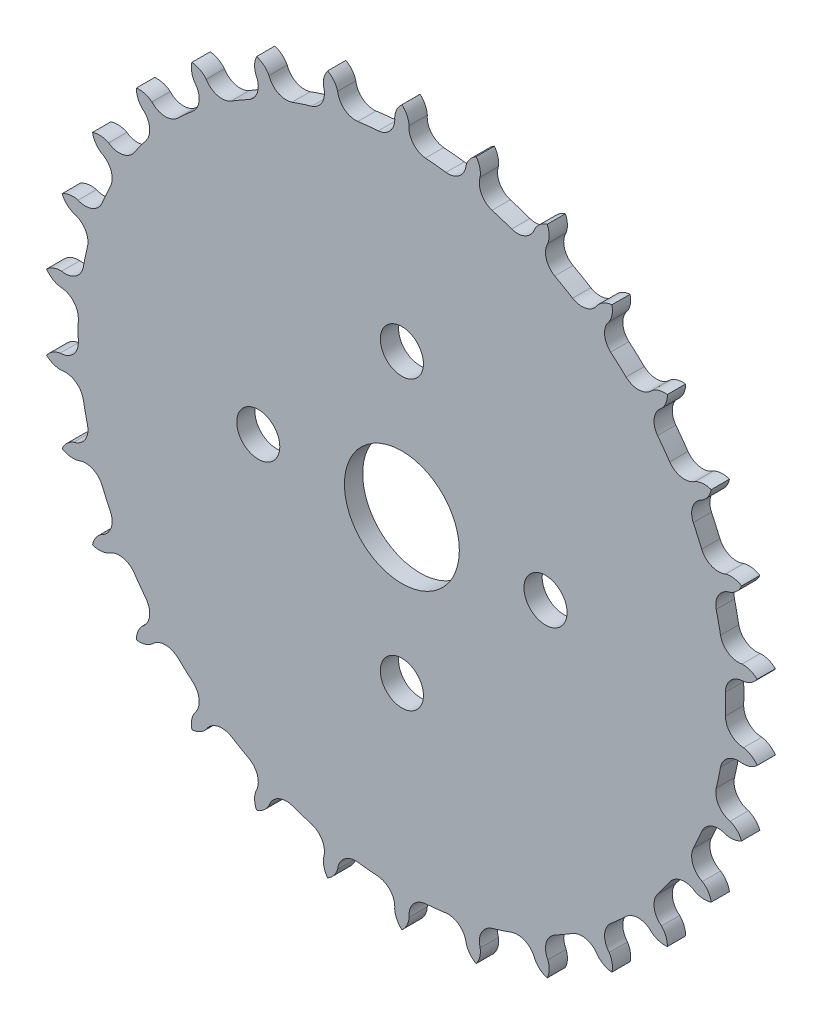
from build123d import *

# Parameters (mm, degrees)
SKETCH1_R           = 1.5
SKETCH1_R_2         = 4
BOSS_EXTRUDE1_DEPTH = 1.27


with BuildPart() as part:
    # Sketch1 → Boss-Extrude1 (new body)
    with BuildSketch(Plane.XY):
        with BuildLine():
            ThreePointArc((-10.640604221, 19.869260188), (-11.26953813, 19.519412618), (-11.886981967, 19.149663661))
            ThreePointArc((-11.886981967, 19.149663661), (-12.849854709, 19.016656043), (-13.624759144, 19.603459299))
            ThreePointArc((-13.624759144, 19.603459299), (-14.070288868, 19.963072671), (-14.620100137, 20.122841504))
            ThreePointArc((-14.620100137, 20.122841504), (-14.638051973, 19.550568629), (-14.433715589, 19.015718039))
            ThreePointArc((-14.433715589, 19.015718039), (-14.115091167, 18.097407948), (-14.53913297, 17.222763166))
            ThreePointArc((-14.53913297, 17.222763166), (-15.081585764, 16.749797893), (-15.608661841, 16.259755046))
            ThreePointArc((-15.608661841, 16.259755046), (-16.522839665, 15.929461463), (-17.402813836, 16.342329969))
            ThreePointArc((-17.402813836, 16.342329969), (-17.913375491, 16.601454087), (-18.484389873, 16.643419398))
            ThreePointArc((-18.484389873, 16.643419398), (-18.382967197, 16.079919662), (-18.071894363, 15.599240763))
            ThreePointArc((-18.071894363, 15.599240763), (-17.569305245, 14.767243693), (-17.802231842, 13.82354875))
            ThreePointArc((-17.802231842, 13.82354875), (-18.234495731, 13.248136625), (-18.648168294, 12.659217112))
            ThreePointArc((-18.648168294, 12.659217112), (-19.473697242, 12.146072979), (-20.420282056, 12.3669624))
            ThreePointArc((-20.420282056, 12.3669624), (-20.973561647, 12.514272298), (-21.540823073, 12.4366))
            ThreePointArc((-21.540823073, 12.4366), (-21.324458543, 11.906501045), (-20.920244634, 11.501001813))
            ThreePointArc((-20.920244634, 11.501001813), (-20.255656377, 10.791680028), (-20.287287758, 9.820178921))
            ThreePointArc((-20.287287758, 9.820178921), (-20.590470736, 9.167468216), (-20.872660309, 8.505410644))
            ThreePointArc((-20.872660309, 8.505410644), (-21.573460805, 7.831842823), (-22.545285962, 7.851099231))
            ThreePointArc((-22.545285962, 7.851099231), (-23.117102516, 7.880156759), (-23.655818941, 7.686241504))
            ThreePointArc((-23.655818941, 7.686241504), (-23.333968725, 7.212711199), (-22.854279828, 6.900113895))
            ThreePointArc((-22.854279828, 6.900113895), (-22.056738128, 6.344468161), (-21.885691849, 5.38762015))
            ThreePointArc((-21.885691849, 5.38762015), (-22.046543366, 4.686137454), (-22.184916911, 3.979876918))
            ThreePointArc((-22.184916911, 3.979876918), (-22.730360609, 3.175323553), (-23.684952687, 2.992105352))
            ThreePointArc((-23.684952687, 2.992105352), (-24.250315078, 2.901640556), (-24.736942008, 2.599957373))
            ThreePointArc((-24.736942008, 2.599957373), (-24.323672505, 2.203691263), (-23.789473327, 1.997657889))
            ThreePointArc((-23.789473327, 1.997657889), (-22.893834583, 1.619972592), (-22.527586188, 0.719596527))
            ThreePointArc((-22.527586188, 0.719596527), (-22.539076259, 0), (-22.527586188, -0.719596527))
            ThreePointArc((-22.527586188, -0.719596527), (-22.893834583, -1.619972592), (-23.789473327, -1.997657889))
            ThreePointArc((-23.789473327, -1.997657889), (-24.323672505, -2.203691263), (-24.736942008, -2.599957373))
            ThreePointArc((-24.736942008, -2.599957373), (-24.250315078, -2.901640556), (-23.684952687, -2.992105352))
            ThreePointArc((-23.684952687, -2.992105352), (-22.730360609, -3.175323553), (-22.184916911, -3.979876918))
            ThreePointArc((-22.184916911, -3.979876918), (-22.046543366, -4.686137454), (-21.885691849, -5.38762015))
            ThreePointArc((-21.885691849, -5.38762015), (-22.056738128, -6.344468161), (-22.854279828, -6.900113895))
            ThreePointArc((-22.854279828, -6.900113895), (-23.333968725, -7.212711199), (-23.655818941, -7.686241504))
            ThreePointArc((-23.655818941, -7.686241504), (-23.117102516, -7.880156759), (-22.545285962, -7.851099231))
            ThreePointArc((-22.545285962, -7.851099231), (-21.573460805, -7.831842823), (-20.872660309, -8.505410644))
            ThreePointArc((-20.872660309, -8.505410644), (-20.590470736, -9.167468216), (-20.287287758, -9.820178921))
            ThreePointArc((-20.287287758, -9.820178921), (-20.255656377, -10.791680028), (-20.920244634, -11.501001813))
            ThreePointArc((-20.920244634, -11.501001813), (-21.324458543, -11.906501045), (-21.540823073, -12.4366))
            ThreePointArc((-21.540823073, -12.4366), (-20.973561647, -12.514272298), (-20.420282056, -12.3669624))
            ThreePointArc((-20.420282056, -12.3669624), (-19.473697242, -12.146072979), (-18.648168294, -12.659217112))
            ThreePointArc((-18.648168294, -12.659217112), (-18.234495731, -13.248136625), (-17.802231842, -13.82354875))
            ThreePointArc((-17.802231842, -13.82354875), (-17.569305245, -14.767243693), (-18.071894363, -15.599240763))
            ThreePointArc((-18.071894363, -15.599240763), (-18.382967197, -16.079919662), (-18.484389873, -16.643419398))
            ThreePointArc((-18.484389873, -16.643419398), (-17.913375491, -16.601454087), (-17.402813836, -16.342329969))
            ThreePointArc((-17.402813836, -16.342329969), (-16.522839665, -15.929461463), (-15.608661841, -16.259755046))
            ThreePointArc((-15.608661841, -16.259755046), (-15.081585764, -16.749797893), (-14.53913297, -17.222763166))
            ThreePointArc((-14.53913297, -17.222763166), (-14.115091167, -18.097407948), (-14.433715589, -19.015718039))
            ThreePointArc((-14.433715589, -19.015718039), (-14.638051973, -19.550568629), (-14.620100137, -20.122841504))
            ThreePointArc((-14.620100137, -20.122841504), (-14.070288868, -19.963072671), (-13.624759144, -19.603459299))
            ThreePointArc((-13.624759144, -19.603459299), (-12.849854709, -19.016656043), (-11.886981967, -19.149663661))
            ThreePointArc((-11.886981967, -19.149663661), (-11.26953813, -19.519412618), (-10.640604221, -19.869260188))
            ThreePointArc((-10.640604221, -19.869260188), (-10.043979873, -20.636628634), (-10.164714183, -21.601117189))
            ThreePointArc((-10.164714183, -21.601117189), (-10.253383637, -22.166763934), (-10.116841871, -22.722798877))
            ThreePointArc((-10.116841871, -22.722798877), (-9.612263105, -22.452209185), (-9.251237098, -22.007823391))
            ThreePointArc((-9.251237098, -22.007823391), (-8.615269442, -21.272731502), (-7.64578394, -21.202640084))
            ThreePointArc((-7.64578394, -21.202640084), (-6.964957602, -21.435935347), (-6.277030008, -21.647375196))
            ThreePointArc((-6.277030008, -21.647375196), (-5.533898463, -22.273929624), (-5.451465992, -23.242443864))
            ThreePointArc((-5.451465992, -23.242443864), (-5.420593234, -23.814165286), (-5.171429068, -24.329660903))
            ThreePointArc((-5.171429068, -24.329660903), (-4.73413532, -23.96007642), (-4.473391599, -23.450339994))
            ThreePointArc((-4.473391599, -23.450339994), (-4.00415556, -22.599086516), (-3.070428467, -22.328959394))
            ThreePointArc((-3.070428467, -22.328959394), (-2.355975005, -22.415604841), (-1.639119464, -22.479396033))
            ThreePointArc((-1.639119464, -22.479396033), (-0.781959135, -22.937753007), (-0.499962578, -23.867964213))
            ThreePointArc((-0.499962578, -23.867964213), (-0.350896896, -24.420773343), (0, -24.8732))
            ThreePointArc((0, -24.8732), (0.350896896, -24.420773343), (0.499962578, -23.867964213))
            ThreePointArc((0.499962578, -23.867964213), (0.781959135, -22.937753007), (1.639119464, -22.479396033))
            ThreePointArc((1.639119464, -22.479396033), (2.355975005, -22.415604841), (3.070428467, -22.328959394))
            ThreePointArc((3.070428467, -22.328959394), (4.00415556, -22.599086516), (4.473391599, -23.450339994))
            ThreePointArc((4.473391599, -23.450339994), (4.73413532, -23.96007642), (5.171429068, -24.329660903))
            ThreePointArc((5.171429068, -24.329660903), (5.420593234, -23.814165286), (5.451465992, -23.242443864))
            ThreePointArc((5.451465992, -23.242443864), (5.533898463, -22.273929624), (6.277030008, -21.647375196))
            ThreePointArc((6.277030008, -21.647375196), (6.964957602, -21.435935347), (7.64578394, -21.202640084))
            ThreePointArc((7.64578394, -21.202640084), (8.615269442, -21.272731502), (9.251237098, -22.007823391))
            ThreePointArc((9.251237098, -22.007823391), (9.612263105, -22.452209185), (10.116841871, -22.722798877))
            ThreePointArc((10.116841871, -22.722798877), (10.253383637, -22.166763934), (10.164714183, -21.601117189))
            ThreePointArc((10.164714183, -21.601117189), (10.043979873, -20.636628634), (10.640604221, -19.869260188))
            ThreePointArc((10.640604221, -19.869260188), (11.26953813, -19.519412618), (11.886981967, -19.149663661))
            ThreePointArc((11.886981967, -19.149663661), (12.849854709, -19.016656043), (13.624759144, -19.603459299))
            ThreePointArc((13.624759144, -19.603459299), (14.070288868, -19.963072671), (14.620100137, -20.122841504))
            ThreePointArc((14.620100137, -20.122841504), (14.638051973, -19.550568629), (14.433715589, -19.015718039))
            ThreePointArc((14.433715589, -19.015718039), (14.115091167, -18.097407948), (14.53913297, -17.222763166))
            ThreePointArc((14.53913297, -17.222763166), (15.081585764, -16.749797893), (15.608661841, -16.259755046))
            ThreePointArc((15.608661841, -16.259755046), (16.522839665, -15.929461463), (17.402813836, -16.342329969))
            ThreePointArc((17.402813836, -16.342329969), (17.913375491, -16.601454087), (18.484389873, -16.643419398))
            ThreePointArc((18.484389873, -16.643419398), (18.382967197, -16.079919662), (18.071894363, -15.599240763))
            ThreePointArc((18.071894363, -15.599240763), (17.569305245, -14.767243693), (17.802231842, -13.82354875))
            ThreePointArc((17.802231842, -13.82354875), (18.234495731, -13.248136625), (18.648168294, -12.659217112))
            ThreePointArc((18.648168294, -12.659217112), (19.473697242, -12.146072979), (20.420282056, -12.3669624))
            ThreePointArc((20.420282056, -12.3669624), (20.973561647, -12.514272298), (21.540823073, -12.4366))
            ThreePointArc((21.540823073, -12.4366), (21.324458543, -11.906501045), (20.920244634, -11.501001813))
            ThreePointArc((20.920244634, -11.501001813), (20.255656377, -10.791680028), (20.287287758, -9.820178921))
            ThreePointArc((20.287287758, -9.820178921), (20.590470736, -9.167468216), (20.872660309, -8.505410644))
            ThreePointArc((20.872660309, -8.505410644), (21.573460805, -7.831842823), (22.545285962, -7.851099231))
            ThreePointArc((22.545285962, -7.851099231), (23.117102516, -7.880156759), (23.655818941, -7.686241504))
            ThreePointArc((23.655818941, -7.686241504), (23.333968725, -7.212711199), (22.854279828, -6.900113895))
            ThreePointArc((22.854279828, -6.900113895), (22.056738128, -6.344468161), (21.885691849, -5.38762015))
            ThreePointArc((21.885691849, -5.38762015), (22.046543366, -4.686137454), (22.184916911, -3.979876918))
            ThreePointArc((22.184916911, -3.979876918), (22.730360609, -3.175323553), (23.684952687, -2.992105352))
            ThreePointArc((23.684952687, -2.992105352), (24.250315078, -2.901640556), (24.736942008, -2.599957373))
            ThreePointArc((24.736942008, -2.599957373), (24.323672505, -2.203691263), (23.789473327, -1.997657889))
            ThreePointArc((23.789473327, -1.997657889), (22.893834583, -1.619972592), (22.527586188, -0.719596527))
            ThreePointArc((22.527586188, -0.719596527), (22.539076259, 0), (22.527586188, 0.719596527))
            ThreePointArc((22.527586188, 0.719596527), (22.893834583, 1.619972592), (23.789473327, 1.997657889))
            ThreePointArc((23.789473327, 1.997657889), (24.323672505, 2.203691263), (24.736942008, 2.599957373))
            ThreePointArc((24.736942008, 2.599957373), (24.250315078, 2.901640556), (23.684952687, 2.992105352))
            ThreePointArc((23.684952687, 2.992105352), (22.730360609, 3.175323553), (22.184916911, 3.979876918))
            ThreePointArc((22.184916911, 3.979876918), (22.046543366, 4.686137454), (21.885691849, 5.38762015))
            ThreePointArc((21.885691849, 5.38762015), (22.056738128, 6.344468161), (22.854279828, 6.900113895))
            ThreePointArc((22.854279828, 6.900113895), (23.333968725, 7.212711199), (23.655818941, 7.686241504))
            ThreePointArc((23.655818941, 7.686241504), (23.117102516, 7.880156759), (22.545285962, 7.851099231))
            ThreePointArc((22.545285962, 7.851099231), (21.573460805, 7.831842823), (20.872660309, 8.505410644))
            ThreePointArc((20.872660309, 8.505410644), (20.590470736, 9.167468216), (20.287287758, 9.820178921))
            ThreePointArc((20.287287758, 9.820178921), (20.255656377, 10.791680028), (20.920244634, 11.501001813))
            ThreePointArc((20.920244634, 11.501001813), (21.324458543, 11.906501045), (21.540823073, 12.4366))
            ThreePointArc((21.540823073, 12.4366), (20.973561647, 12.514272298), (20.420282056, 12.3669624))
            ThreePointArc((20.420282056, 12.3669624), (19.473697242, 12.146072979), (18.648168294, 12.659217112))
            ThreePointArc((18.648168294, 12.659217112), (18.234495731, 13.248136625), (17.802231842, 13.82354875))
            ThreePointArc((17.802231842, 13.82354875), (17.569305245, 14.767243693), (18.071894363, 15.599240763))
            ThreePointArc((18.071894363, 15.599240763), (18.382967197, 16.079919662), (18.484389873, 16.643419398))
            ThreePointArc((18.484389873, 16.643419398), (17.913375491, 16.601454087), (17.402813836, 16.342329969))
            ThreePointArc((17.402813836, 16.342329969), (16.522839665, 15.929461463), (15.608661841, 16.259755046))
            ThreePointArc((15.608661841, 16.259755046), (15.081585764, 16.749797893), (14.53913297, 17.222763166))
            ThreePointArc((14.53913297, 17.222763166), (14.115091167, 18.097407948), (14.433715589, 19.015718039))
            ThreePointArc((14.433715589, 19.015718039), (14.638051973, 19.550568629), (14.620100137, 20.122841504))
            ThreePointArc((14.620100137, 20.122841504), (14.070288868, 19.963072671), (13.624759144, 19.603459299))
            ThreePointArc((13.624759144, 19.603459299), (12.849854709, 19.016656043), (11.886981967, 19.149663661))
            ThreePointArc((11.886981967, 19.149663661), (11.26953813, 19.519412618), (10.640604221, 19.869260188))
            ThreePointArc((10.640604221, 19.869260188), (10.043979873, 20.636628634), (10.164714183, 21.601117189))
            ThreePointArc((10.164714183, 21.601117189), (10.253383637, 22.166763934), (10.116841871, 22.722798877))
            ThreePointArc((10.116841871, 22.722798877), (9.612263105, 22.452209185), (9.251237098, 22.007823391))
            ThreePointArc((9.251237098, 22.007823391), (8.615269442, 21.272731502), (7.64578394, 21.202640084))
            ThreePointArc((7.64578394, 21.202640084), (6.964957602, 21.435935347), (6.277030008, 21.647375196))
            ThreePointArc((6.277030008, 21.647375196), (5.533898463, 22.273929624), (5.451465992, 23.242443864))
            ThreePointArc((5.451465992, 23.242443864), (5.420593234, 23.814165286), (5.171429068, 24.329660903))
            ThreePointArc((5.171429068, 24.329660903), (4.73413532, 23.96007642), (4.473391599, 23.450339994))
            ThreePointArc((4.473391599, 23.450339994), (4.00415556, 22.599086516), (3.070428467, 22.328959394))
            ThreePointArc((3.070428467, 22.328959394), (2.355975005, 22.415604841), (1.639119464, 22.479396033))
            ThreePointArc((1.639119464, 22.479396033), (0.781959135, 22.937753007), (0.499962578, 23.867964213))
            ThreePointArc((0.499962578, 23.867964213), (0.350896896, 24.420773343), (0, 24.8732))
            ThreePointArc((0, 24.8732), (-0.350896896, 24.420773343), (-0.499962578, 23.867964213))
            ThreePointArc((-0.499962578, 23.867964213), (-0.781959135, 22.937753007), (-1.639119464, 22.479396033))
            ThreePointArc((-1.639119464, 22.479396033), (-2.355975005, 22.415604841), (-3.070428467, 22.328959394))
            ThreePointArc((-3.070428467, 22.328959394), (-4.00415556, 22.599086516), (-4.473391599, 23.450339994))
            ThreePointArc((-4.473391599, 23.450339994), (-4.73413532, 23.96007642), (-5.171429068, 24.329660903))
            ThreePointArc((-5.171429068, 24.329660903), (-5.420593234, 23.814165286), (-5.451465992, 23.242443864))
            ThreePointArc((-5.451465992, 23.242443864), (-5.533898463, 22.273929624), (-6.277030008, 21.647375196))
            ThreePointArc((-6.277030008, 21.647375196), (-6.964957602, 21.435935347), (-7.64578394, 21.202640084))
            ThreePointArc((-7.64578394, 21.202640084), (-8.615269442, 21.272731502), (-9.251237098, 22.007823391))
            ThreePointArc((-9.251237098, 22.007823391), (-9.612263105, 22.452209185), (-10.116841871, 22.722798877))
            ThreePointArc((-10.116841871, 22.722798877), (-10.253383637, 22.166763934), (-10.164714183, 21.601117189))
            ThreePointArc((-10.164714183, 21.601117189), (-10.043979873, 20.636628634), (-10.640604221, 19.869260188))
        make_face()
        with Locations((0, 10)):
            Circle(SKETCH1_R, mode=Mode.SUBTRACT)
        Circle(SKETCH1_R_2, mode=Mode.SUBTRACT)
        with Locations((10, 0)):
            Circle(SKETCH1_R, mode=Mode.SUBTRACT)
        with Locations((0, -10)):
            Circle(SKETCH1_R, mode=Mode.SUBTRACT)
        with Locations((-10, 0)):
            Circle(SKETCH1_R, mode=Mode.SUBTRACT)
    extrude(amount=BOSS_EXTRUDE1_DEPTH)


solid = part.part
